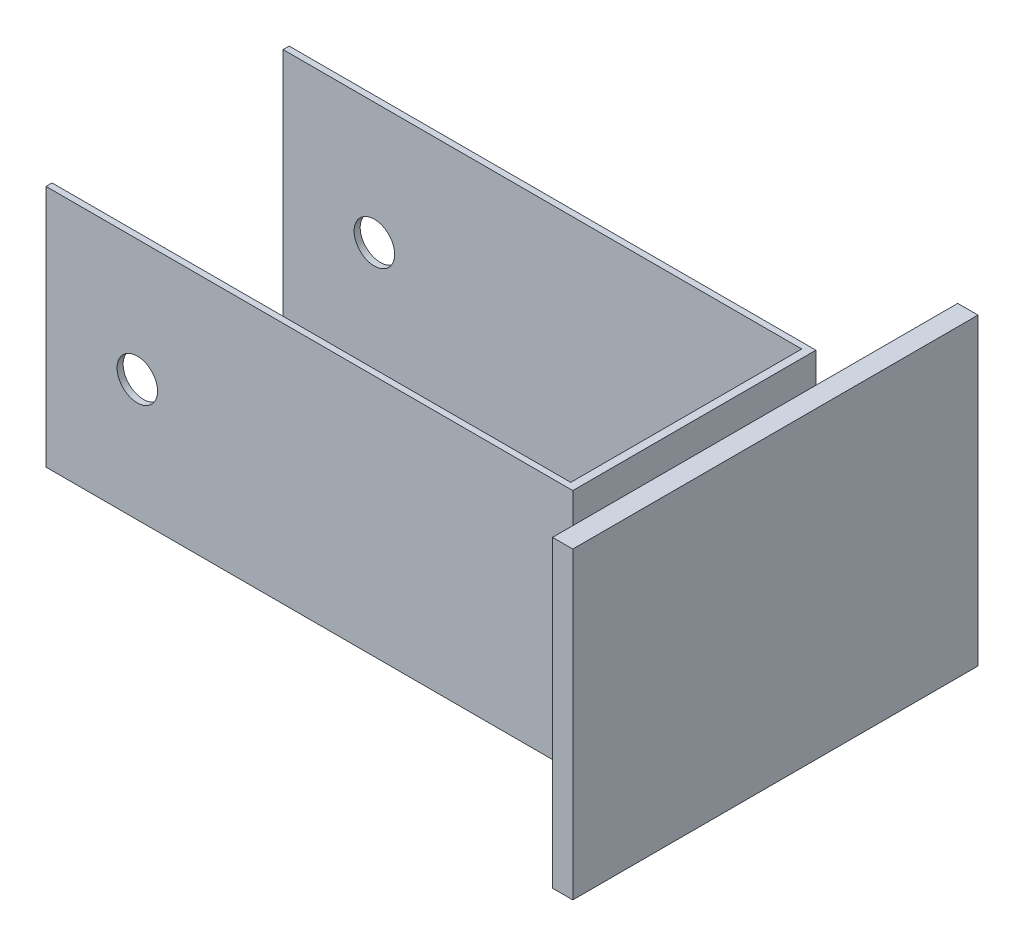
from build123d import *

# Parameters (mm, degrees)
RESSALTO_EXTRUS_O1_DEPTH   = 60
CORTE_EXTRUS_O1_DEPTH      = 148.170653102
CORTE_EXTRUS_O1_DEPTH_BACK = 148.170653102
CORTE_EXTRUS_O2_DEPTH      = 148.170653102
CORTE_EXTRUS_O2_DEPTH_BACK = 148.170653102
ESBO_O5_W                  = 126
ESBO_O5_H                  = 57
ESBO_O6_W                  = 57
ESBO_O6_H                  = 60
CORTE_EXTRUS_O3_DEPTH      = 57
CORTE_EXTRUS_O4_DEPTH      = 148.170653102
CORTE_EXTRUS_O4_DEPTH_BACK = 57
ESBO_O7_R                  = 5
CORTE_EXTRUS_O5_DEPTH      = 148.170653102
CORTE_EXTRUS_O5_DEPTH_BACK = 148.170653102
ESBO_O8_W                  = 65.993133921
ESBO_O8_H                  = 60
ESBO_O13_R                 = 15
RESSALTO_EXTRUS_O2_DEPTH   = 15
ESBO_O14_W                 = 100
ESBO_O14_H                 = 75
RESSALTO_EXTRUS_O3_DEPTH   = 5


with BuildPart() as part:
    # Esboço1 → Ressalto-extrusão1 (new body)
    with BuildSketch(Plane.XY):
        with BuildLine():
            Line((65, 30), (-65, 30))
            Line((-65, 30), (-65, -30))
            Line((-65, -30), (65, -30))
            ThreePointArc((65, -30), (101.246012625, -22.148036763), (130.993133921, 0))
            ThreePointArc((130.993133921, 0), (101.246012625, 22.148036763), (65, 30))
        make_face()
    extrude(amount=RESSALTO_EXTRUS_O1_DEPTH)

    # Esboço3 → Corte-extrusão1 (cut, two sides: drawn at the far end of the back side and taken through both)
    with BuildSketch(Plane.XY.offset(-CORTE_EXTRUS_O1_DEPTH_BACK)):
        with BuildLine():
            Line((65, 25), (65, -25))
            ThreePointArc((65, -25), (88.305470739, -18.221231084), (104.339291624, 0))
            ThreePointArc((104.339291624, 0), (88.305470739, 18.221231084), (65, 25))
        make_face()
    extrude(amount=CORTE_EXTRUS_O1_DEPTH + CORTE_EXTRUS_O1_DEPTH_BACK, mode=Mode.SUBTRACT)

    # Esboço5 → Corte-extrusão2 (cut, two sides: drawn at the far end of the back side and taken through both)
    with BuildSketch(Plane(origin=(0, 0, 0), x_dir=(1, 0, 0), z_dir=(0, 1, 0)).offset(-CORTE_EXTRUS_O2_DEPTH_BACK)):
        with Locations((0, -30)):
            Rectangle(ESBO_O5_W, ESBO_O5_H)
    extrude(amount=CORTE_EXTRUS_O2_DEPTH + CORTE_EXTRUS_O2_DEPTH_BACK, mode=Mode.SUBTRACT)

    # Esboço6 → Corte-extrusão3 (cut)
    with BuildSketch(Plane(origin=(-63, 0, 0), x_dir=(0, 0, -1), z_dir=(1, 0, 0))):
        with Locations((-30, 0)):
            Rectangle(ESBO_O6_W, ESBO_O6_H)
    extrude(amount=-CORTE_EXTRUS_O3_DEPTH, mode=Mode.SUBTRACT)

    # Esboço7 → Corte-extrusão4 (cut, two sides: drawn at the far end of the back side and taken through both)
    with BuildSketch(Plane.XY.offset(-CORTE_EXTRUS_O4_DEPTH_BACK)):
        with Locations((-42.467037106, 0)):
            Circle(ESBO_O7_R)
    extrude(amount=CORTE_EXTRUS_O4_DEPTH + CORTE_EXTRUS_O4_DEPTH_BACK, mode=Mode.SUBTRACT)

    # Esboço8 → Corte-extrusão5 (cut, two sides: drawn at the far end of the back side and taken through both)
    with BuildSketch(Plane(origin=(0, 0, 0), x_dir=(1, 0, 0), z_dir=(0, 1, 0)).offset(-CORTE_EXTRUS_O5_DEPTH_BACK)):
        with Locations((97.996566961, -30)):
            Rectangle(ESBO_O8_W, ESBO_O8_H)
    extrude(amount=CORTE_EXTRUS_O5_DEPTH + CORTE_EXTRUS_O5_DEPTH_BACK, mode=Mode.SUBTRACT)

    # Esboço13 → Ressalto-extrusão2 (add)
    with BuildSketch(Plane(origin=(65, 0, 0), x_dir=(0, 0, -1), z_dir=(1, 0, 0))):
        with Locations((-30, 0)):
            Circle(ESBO_O13_R)
    extrude(amount=RESSALTO_EXTRUS_O2_DEPTH)

    # Esboço14 → Ressalto-extrusão3 (add)
    with BuildSketch(Plane(origin=(80, 0, 0), x_dir=(0, 0, -1), z_dir=(1, 0, 0))):
        with Locations((-30, 0)):
            Rectangle(ESBO_O14_W, ESBO_O14_H)
    extrude(amount=RESSALTO_EXTRUS_O3_DEPTH)


solid = part.part
